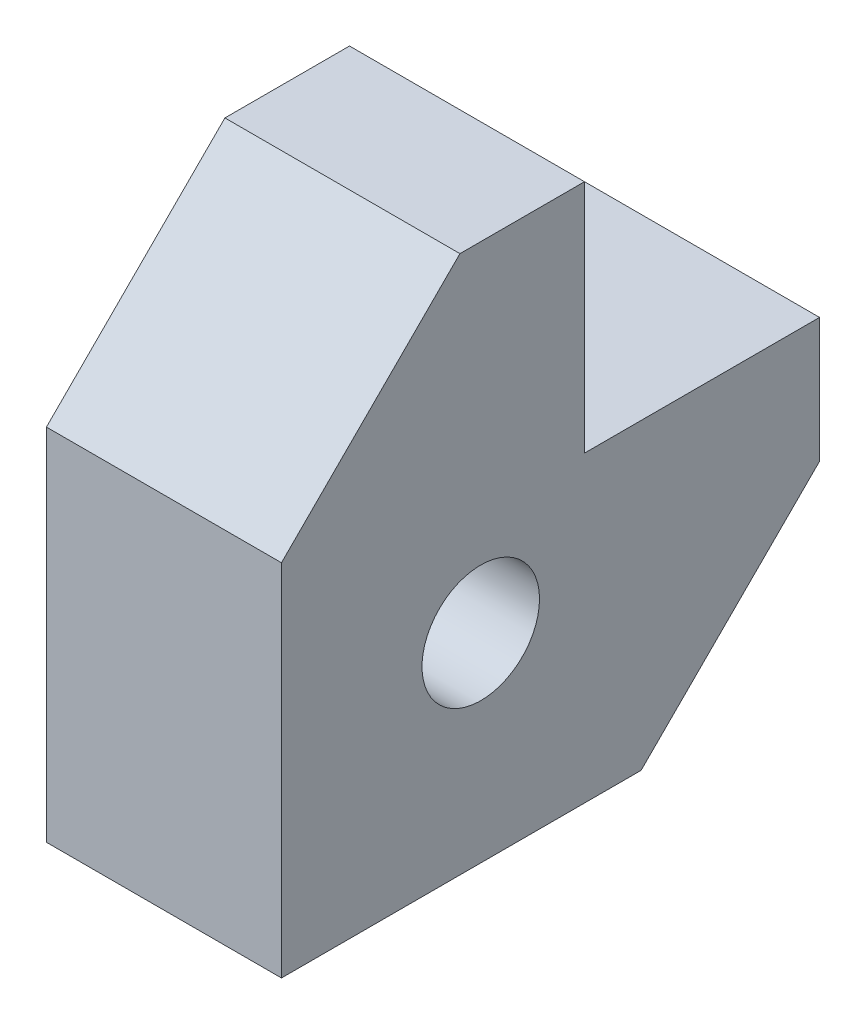
from build123d import *

# Parameters (mm, degrees)
SKIZZE1_R                       = 5
AUFSATZ_LINEAR_AUSTRAGEN1_DEPTH = 20


with BuildPart() as part:
    # Skizze1 → Aufsatz-Linear austragen1 (new body)
    with BuildSketch(Plane(origin=(0, 0, 0), x_dir=(0, 0, -1), z_dir=(1, 0, 0))):
        Polygon((0, 0), (0, 20), (-10.600988733, 20), (-25.787709792, 4.813278942), (-25.787709792, -25.787709792), (4.813278942, -25.787709792), (20, -10.600988733), (20, 0), align=None)
        with Locations((-8.83007243, -8.83007243)):
            Circle(SKIZZE1_R, mode=Mode.SUBTRACT)
    extrude(amount=AUFSATZ_LINEAR_AUSTRAGEN1_DEPTH)


solid = part.part
